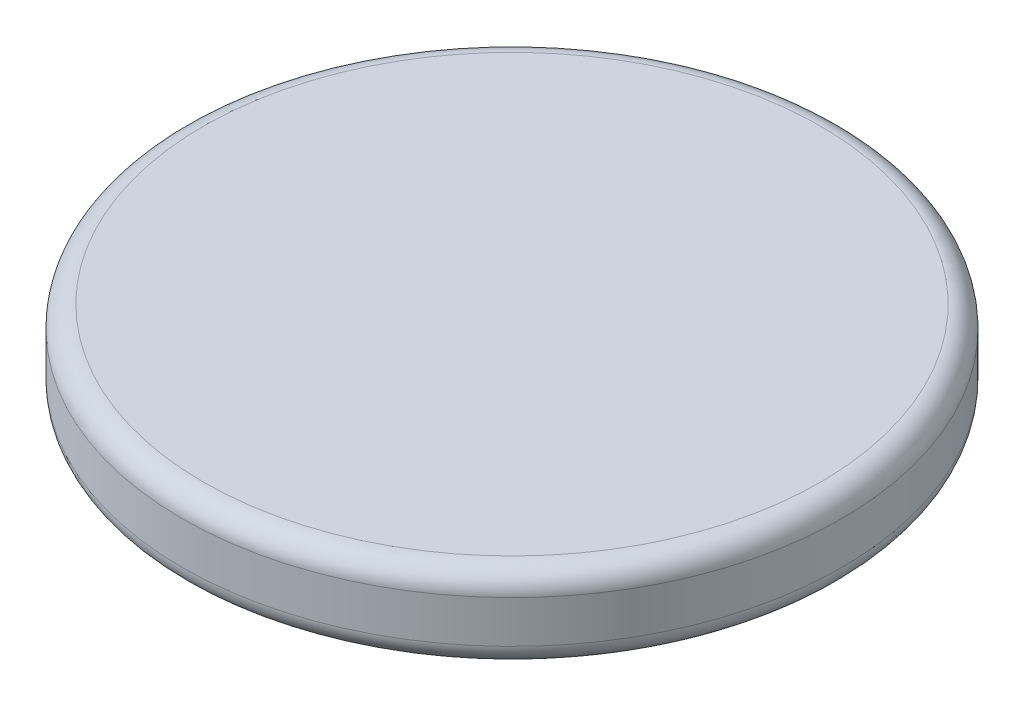
from build123d import *

# Parameters (mm, degrees)
SKETCH1_R           = 49.53
BOSS_EXTRUDE1_DEPTH = 12.7
FILLET1_R           = 3.175


with BuildPart() as part:
    # Sketch1 → Boss-Extrude1 (new body)
    with BuildSketch(Plane(origin=(0, 0, 0), x_dir=(1, 0, 0), z_dir=(0, 1, 0))):
        with Locations(Location((0, 0, 0), (0, 0, 270))):
            Circle(SKETCH1_R)
    extrude(amount=BOSS_EXTRUDE1_DEPTH)

    # Fillet1
    fillet1_edges = [part.edges().sort_by_distance(p)[0] for p in [
        (0, 0, -49.53),
        (0, 12.7, -49.53),
    ]]
    fillet(fillet1_edges, radius=FILLET1_R)


solid = part.part
